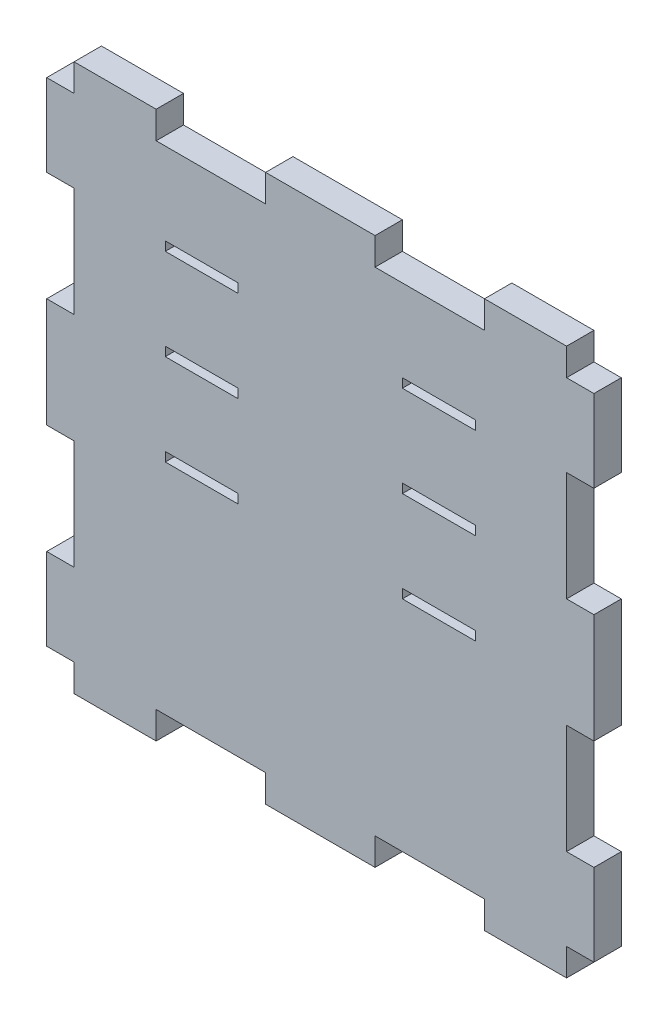
from build123d import *

# Parameters (mm, degrees)
SKETCH1_W           = 190.5
SKETCH1_H           = 190.5
BOSS_EXTRUDE2_DEPTH = 9.525
SKETCH2_W           = 38.1
SKETCH2_H           = 9.525
CUT_EXTRUDE1_DEPTH  = 9.525
SKETCH3_W           = 38.1
SKETCH3_H           = 9.525
CUT_EXTRUDE2_DEPTH  = 9.525
SKETCH4_W           = 9.525
SKETCH4_H           = 38.1
CUT_EXTRUDE3_DEPTH  = 9.525
SKETCH5_W           = 9.525
SKETCH5_H           = 38.1
CUT_EXTRUDE4_DEPTH  = 9.525
SKETCH6_W           = 38.1
SKETCH6_H           = 9.525
CUT_EXTRUDE5_DEPTH  = 9.525
SKETCH7_W           = 38.1
SKETCH7_H           = 9.525
CUT_EXTRUDE6_DEPTH  = 9.525
SKETCH8_W           = 9.525
SKETCH8_H           = 38.1
CUT_EXTRUDE7_DEPTH  = 9.525
SKETCH9_W           = 9.525
SKETCH9_H           = 38.1
CUT_EXTRUDE8_DEPTH  = 9.525
SKETCH10_W          = 9.525
SKETCH10_H          = 9.525
CUT_EXTRUDE9_DEPTH  = 9.525
SKETCH11_W          = 9.525
SKETCH11_H          = 9.525
CUT_EXTRUDE10_DEPTH = 9.525
SKETCH12_W          = 9.525
SKETCH12_H          = 9.525
CUT_EXTRUDE11_DEPTH = 9.525
SKETCH13_W          = 9.525
SKETCH13_H          = 9.525
CUT_EXTRUDE12_DEPTH = 9.525
SKETCH14_W          = 25.4
SKETCH14_H          = 3.175
CUT_EXTRUDE13_DEPTH = 204.230898008


with BuildPart() as part:
    # Sketch1 → Boss-Extrude2 (new body)
    with BuildSketch(Plane.XY):
        with Locations((26.090217391, -67.50326087)):
            Rectangle(SKETCH1_W, SKETCH1_H)
    extrude(amount=BOSS_EXTRUDE2_DEPTH)

    # Sketch2 → Cut-Extrude1 (cut)
    with BuildSketch(Plane.XY.offset(9.525)):
        with Locations((-12.009782609, 22.98423913)):
            Rectangle(SKETCH2_W, SKETCH2_H)
    extrude(amount=-CUT_EXTRUDE1_DEPTH, mode=Mode.SUBTRACT)

    # Sketch3 → Cut-Extrude2 (cut)
    with BuildSketch(Plane.XY.offset(9.525)):
        with Locations((64.190217391, 22.98423913)):
            Rectangle(SKETCH3_W, SKETCH3_H)
    extrude(amount=-CUT_EXTRUDE2_DEPTH, mode=Mode.SUBTRACT)

    # Sketch4 → Cut-Extrude3 (cut)
    with BuildSketch(Plane.XY.offset(9.525)):
        with Locations((116.577717391, -29.40326087)):
            Rectangle(SKETCH4_W, SKETCH4_H)
    extrude(amount=-CUT_EXTRUDE3_DEPTH, mode=Mode.SUBTRACT)

    # Sketch5 → Cut-Extrude4 (cut)
    with BuildSketch(Plane.XY.offset(9.525)):
        with Locations((116.577717391, -105.60326087)):
            Rectangle(SKETCH5_W, SKETCH5_H)
    extrude(amount=-CUT_EXTRUDE4_DEPTH, mode=Mode.SUBTRACT)

    # Sketch6 → Cut-Extrude5 (cut)
    with BuildSketch(Plane.XY.offset(9.525)):
        with Locations((64.190217391, -157.99076087)):
            Rectangle(SKETCH6_W, SKETCH6_H)
    extrude(amount=-CUT_EXTRUDE5_DEPTH, mode=Mode.SUBTRACT)

    # Sketch7 → Cut-Extrude6 (cut)
    with BuildSketch(Plane.XY.offset(9.525)):
        with Locations((-12.009782609, -157.99076087)):
            Rectangle(SKETCH7_W, SKETCH7_H)
    extrude(amount=-CUT_EXTRUDE6_DEPTH, mode=Mode.SUBTRACT)

    # Sketch8 → Cut-Extrude7 (cut)
    with BuildSketch(Plane.XY.offset(9.525)):
        with Locations((-64.397282609, -105.60326087)):
            Rectangle(SKETCH8_W, SKETCH8_H)
    extrude(amount=-CUT_EXTRUDE7_DEPTH, mode=Mode.SUBTRACT)

    # Sketch9 → Cut-Extrude8 (cut)
    with BuildSketch(Plane.XY.offset(9.525)):
        with Locations((-64.397282609, -29.40326087)):
            Rectangle(SKETCH9_W, SKETCH9_H)
    extrude(amount=-CUT_EXTRUDE8_DEPTH, mode=Mode.SUBTRACT)

    # Sketch10 → Cut-Extrude9 (cut)
    with BuildSketch(Plane.XY.offset(9.525)):
        with Locations((-64.397282609, -157.99076087)):
            Rectangle(SKETCH10_W, SKETCH10_H)
    extrude(amount=-CUT_EXTRUDE9_DEPTH, mode=Mode.SUBTRACT)

    # Sketch11 → Cut-Extrude10 (cut)
    with BuildSketch(Plane.XY.offset(9.525)):
        with Locations((-64.397282609, 22.98423913)):
            Rectangle(SKETCH11_W, SKETCH11_H)
    extrude(amount=-CUT_EXTRUDE10_DEPTH, mode=Mode.SUBTRACT)

    # Sketch12 → Cut-Extrude11 (cut)
    with BuildSketch(Plane.XY.offset(9.525)):
        with Locations((116.577717391, 22.98423913)):
            Rectangle(SKETCH12_W, SKETCH12_H)
    extrude(amount=-CUT_EXTRUDE11_DEPTH, mode=Mode.SUBTRACT)

    # Sketch13 → Cut-Extrude12 (cut)
    with BuildSketch(Plane.XY.offset(9.525)):
        with Locations((116.577717391, -157.99076087)):
            Rectangle(SKETCH13_W, SKETCH13_H)
    extrude(amount=-CUT_EXTRUDE12_DEPTH, mode=Mode.SUBTRACT)

    # Sketch14 → Cut-Extrude13 (cut, through all)
    with BuildSketch(Plane.XY.offset(9.525)):
        with Locations((67.365217391, -11.94076087)):
            Rectangle(SKETCH14_W, SKETCH14_H)
        with Locations((-15.184782609, -11.94076087)):
            Rectangle(SKETCH14_W, SKETCH14_H)
        with Locations((67.365217391, -43.69076087)):
            Rectangle(SKETCH14_W, SKETCH14_H)
        with Locations((-15.184782609, -43.69076087)):
            Rectangle(SKETCH14_W, SKETCH14_H)
        with Locations((67.365217391, -75.44076087)):
            Rectangle(SKETCH14_W, SKETCH14_H)
        with Locations((-15.184782609, -75.44076087)):
            Rectangle(SKETCH14_W, SKETCH14_H)
    extrude(amount=-CUT_EXTRUDE13_DEPTH, mode=Mode.SUBTRACT)


solid = part.part
